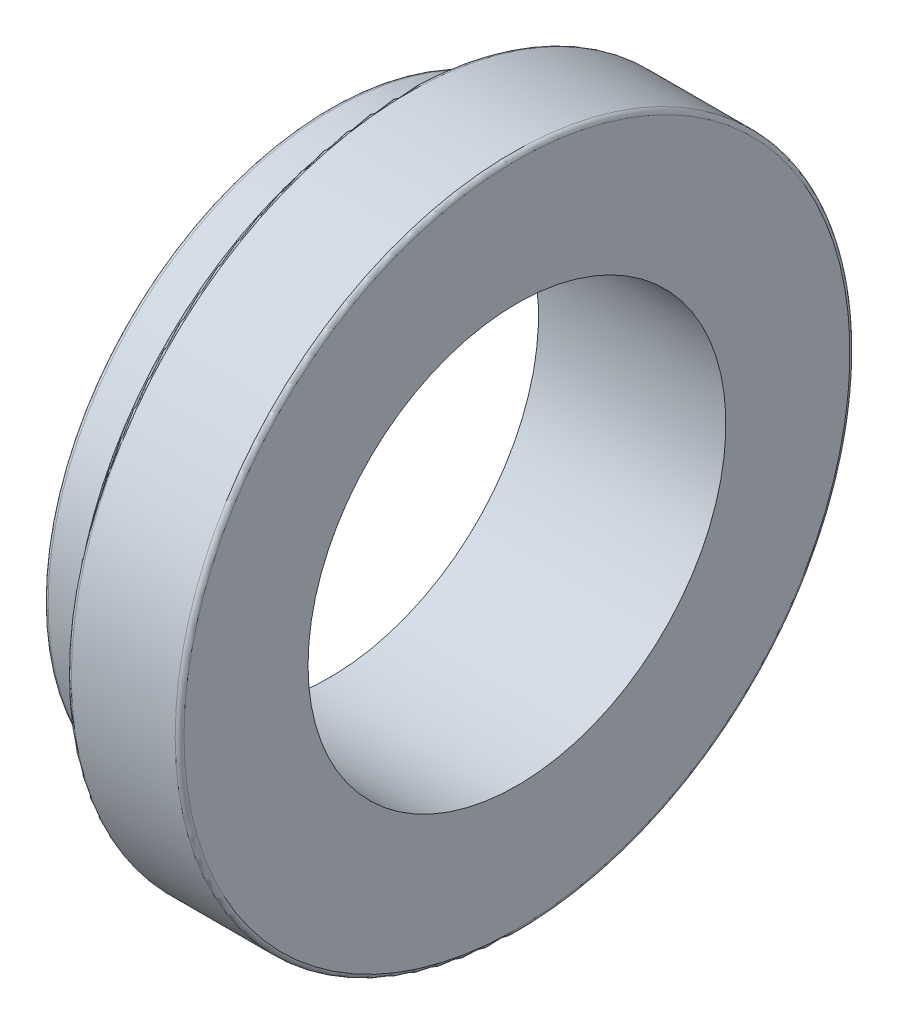
from build123d import *


with BuildPart() as part:
    # Sketch1 → Revolve1 (revolve)
    with BuildSketch(Plane.XY, mode=Mode.PRIVATE) as revolve1_sk:
        with BuildLine():
            Line((1.795946189, 30.1625), (1.795946189, 40.64))
            ThreePointArc((1.795946189, 40.64), (1.981933383, 41.089012806), (2.430946189, 41.275))
            Line((2.430946189, 41.275), (10.685946189, 41.275))
            Line((10.685946189, 41.275), (10.685946189, 45.7835))
            ThreePointArc((10.685946189, 45.7835), (10.760341067, 45.963105122), (10.939946189, 46.0375))
            Line((10.939946189, 46.0375), (12.324748868, 46.0375))
            ThreePointArc((12.324748868, 46.0375), (12.50435399, 46.111894878), (12.578748868, 46.2915))
            Line((12.578748868, 46.2915), (12.578748868, 48.0695))
            ThreePointArc((12.578748868, 48.0695), (12.764736062, 48.518512806), (13.213748868, 48.7045))
            Line((13.213748868, 48.7045), (28.211946189, 48.7045))
            ThreePointArc((28.211946189, 48.7045), (28.660958995, 48.518512806), (28.846946189, 48.0695))
            Line((28.846946189, 48.0695), (28.846946189, 30.1625))
            Line((28.846946189, 30.1625), (1.795946189, 30.1625))
        make_face()
    revolve(revolve1_sk.sketch.rotate(Axis((0, 0, 0), (1, 0, 0)), 90), axis=Axis((0, 0, 0), (1, 0, 0)))


solid = part.part
